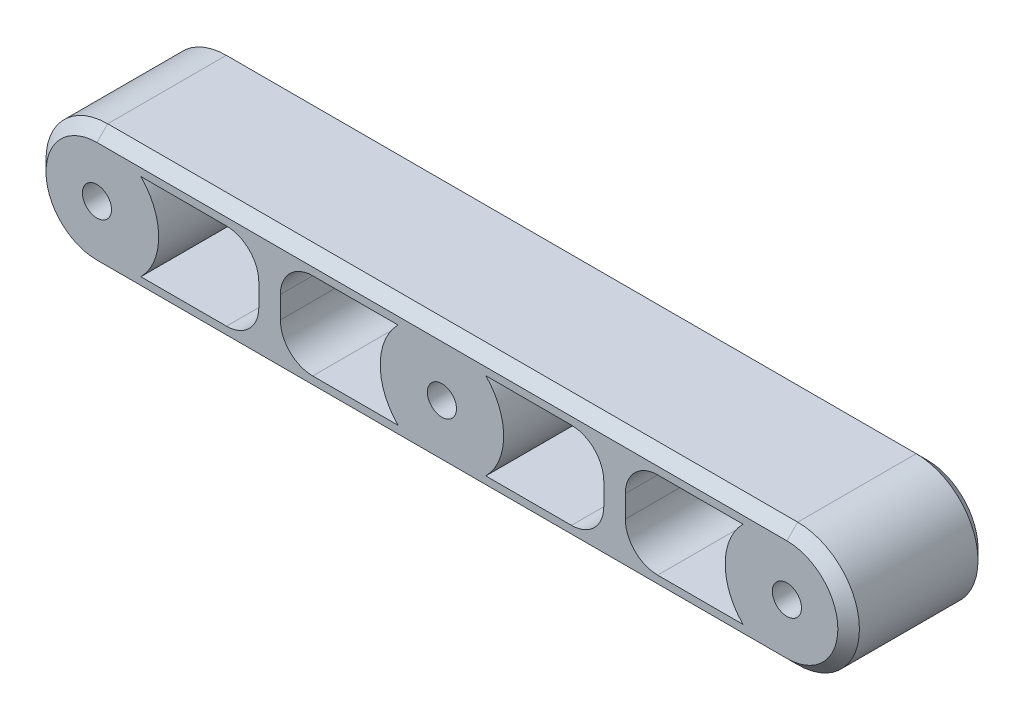
from build123d import *

# Parameters (mm, degrees)
SKETCH_1_R      = 1.35
EXTRUDE_3_DEPTH = 13
FILLET_1_R      = 3
CHAMFER_1_SIZE  = 1


with BuildPart() as part:
    # 草图1 → 凸台-拉伸3 (new body)
    with BuildSketch(Plane.XY):
        with BuildLine():
            Line((3, 11.4514), (35, 11.4514))
            Line((35, 11.4514), (67, 11.4514))
            ThreePointArc((67, 11.4514), (72.7257, 5.7257), (67, 0))
            Line((67, 0), (35, 0))
            Line((35, 0), (3, 0))
            ThreePointArc((3, 0), (-2.7257, 5.7257), (3, 11.4514))
        make_face()
        with Locations(Location((35, 5.7257, 0), (0, 0, 180))):
            Circle(SKETCH_1_R, mode=Mode.SUBTRACT)
        with Locations(Location((3, 5.7257, 0), (0, 0, 180))):
            Circle(SKETCH_1_R, mode=Mode.SUBTRACT)
        with Locations(Location((67, 5.7257, 0), (0, 0, 180))):
            Circle(SKETCH_1_R, mode=Mode.SUBTRACT)
        with BuildLine():
            Line((7.071532881, 9.7514), (18.014251374, 9.7514))
            Line((18.014251374, 9.7514), (18.014251374, 1.7))
            Line((18.014251374, 1.7), (7.071532881, 1.7))
            ThreePointArc((7.071532881, 1.7), (8.7257, 5.7257), (7.071532881, 9.7514))
        make_face(mode=Mode.SUBTRACT)
        with BuildLine():
            Line((20.014251374, 9.7514), (20.014251374, 1.7))
            Line((20.014251374, 1.7), (30.928467119, 1.7))
            ThreePointArc((30.928467119, 1.7), (29.2743, 5.7257), (30.928467119, 9.7514))
            Line((30.928467119, 9.7514), (20.014251374, 9.7514))
        make_face(mode=Mode.SUBTRACT)
        with BuildLine():
            Line((39.071532881, 9.7514), (50.013401562, 9.7514))
            Line((50.013401562, 9.7514), (50.013401562, 1.7))
            Line((50.013401562, 1.7), (39.071532881, 1.7))
            ThreePointArc((39.071532881, 1.7), (40.7257, 5.7257), (39.071532881, 9.7514))
        make_face(mode=Mode.SUBTRACT)
        with BuildLine():
            Line((62.928467119, 9.7514), (52.013401562, 9.7514))
            Line((52.013401562, 9.7514), (52.013401562, 1.7))
            Line((52.013401562, 1.7), (62.928467119, 1.7))
            ThreePointArc((62.928467119, 1.7), (61.2743, 5.7257), (62.928467119, 9.7514))
        make_face(mode=Mode.SUBTRACT)
    extrude(amount=EXTRUDE_3_DEPTH)

    # 圆角1
    fillet_1_edges = [part.edges().sort_by_distance(p)[0] for p in [
        (20.014251374, 9.7514, 6.5),
        (20.014251374, 1.7, 6.5),
        (50.013401562, 1.7, 6.5),
        (50.013401562, 9.7514, 6.5),
        (52.013401562, 9.7514, 6.5),
        (52.013401562, 1.7, 6.5),
        (18.014251374, 1.7, 6.5),
        (18.014251374, 9.7514, 6.5),
    ]]
    fillet(fillet_1_edges, radius=FILLET_1_R)

    # 倒角1
    chamfer_1_edges = [part.edges().sort_by_distance(p)[0] for p in [
        (72.7257, 5.7257, 13),
        (35, 11.4514, 13),
        (-2.7257, 5.7257, 13),
        (35, 11.4514, 0),
        (72.7257, 5.7257, 0),
        (35, 0, 0),
        (-2.7257, 5.7257, 0),
        (35, 0, 13),
    ]]
    chamfer(chamfer_1_edges, length=CHAMFER_1_SIZE)


solid = part.part
